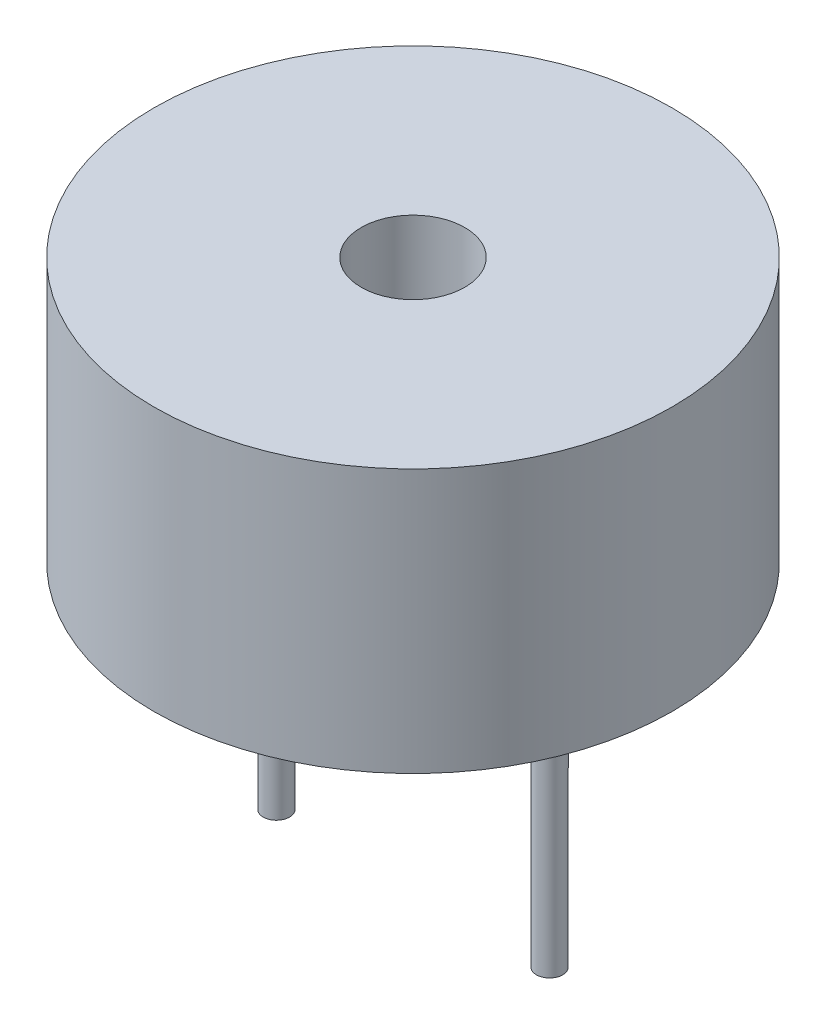
from build123d import *

# Parameters (mm, degrees)
SKETCH2_R      = 6.985
EXTRUDE1_DEPTH = 7.112
SKETCH3_R      = 0.3556
EXTRUDE2_DEPTH = 7.62
SKETCH4_R      = 1.397
EXTRUDE3_DEPTH = 3.81


with BuildPart() as part:
    # Sketch2 → Extrude1 (new body)
    with BuildSketch(Plane(origin=(0, 0, 0), x_dir=(1, 0, 0), z_dir=(0, 1, 0))):
        with Locations(Location((0, 0, 0), (0, 0, 270))):
            Circle(SKETCH2_R)
    extrude(amount=EXTRUDE1_DEPTH)

    # Sketch3 → Extrude2 (add)
    with BuildSketch(Plane.XZ):
        with Locations(Location((3.683, 0, 0), (0, 0, 90))):
            Circle(SKETCH3_R)
        with Locations(Location((-3.683, 0, 0), (0, 0, 90))):
            Circle(SKETCH3_R)
    extrude(amount=EXTRUDE2_DEPTH)

    # Sketch4 → Extrude3 (cut)
    with BuildSketch(Plane(origin=(0, 7.112, 0), x_dir=(1, 0, 0), z_dir=(0, 1, 0))):
        with Locations(Location((0, 0, 0), (0, 0, 270))):
            Circle(SKETCH4_R)
    extrude(amount=-EXTRUDE3_DEPTH, mode=Mode.SUBTRACT)


solid = part.part
